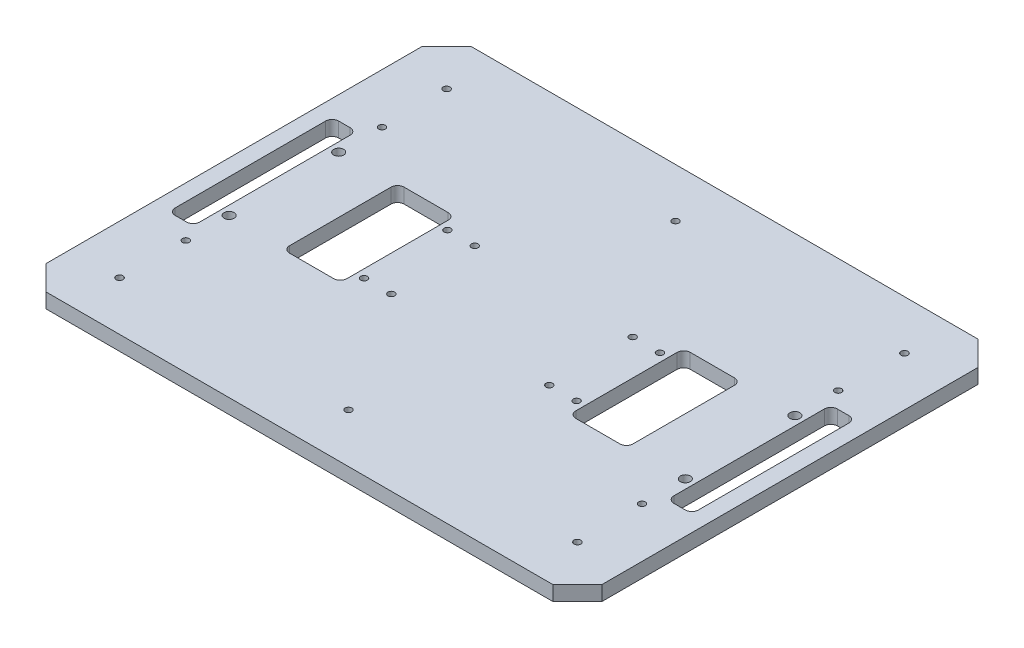
from build123d import *

# Parameters (mm, degrees)
ESQUISSE3_R                  = 2.1
BOSS_EXTRU_2_DEPTH           = 9
ESQUISSE4_R                  = 3.05
ENL_V_MAT_EXTRU_3_DEPTH      = 5
ESQUISSE5_R                  = 2.05
ENL_V_MAT_EXTRU_4_DEPTH      = 215.198506064
ENL_V_MAT_EXTRU_5_DEPTH      = 215.198506064
ENL_V_MAT_EXTRU_5_DEPTH_BACK = 215.198506064
ESQUISSE6_R                  = 2.05
ESQUISSE7_R                  = 2.05
ENL_V_MAT_EXTRU_6_DEPTH      = 215.198506064


with BuildPart() as part:
    # Esquisse3 → Boss.-Extru.2 (new body)
    with BuildSketch(Plane(origin=(0, 0, 0), x_dir=(1, 0, 0), z_dir=(0, 1, 0))):
        Polygon((155, 130), (-155, 130), (-170, 115), (-170, -115), (-155, -130), (155, -130), (170, -115), (170, 115), align=None)
        with Locations(Location((-140, 100, 0), (0, 0, 270))):
            Circle(ESQUISSE3_R, mode=Mode.SUBTRACT)
        with Locations(Location((-140, -100, 0), (0, 0, 90))):
            Circle(ESQUISSE3_R, mode=Mode.SUBTRACT)
        with Locations(Location((140, -100, 0), (0, 0, 270))):
            Circle(ESQUISSE3_R, mode=Mode.SUBTRACT)
        with Locations(Location((140, 100, 0), (0, 0, 90))):
            Circle(ESQUISSE3_R, mode=Mode.SUBTRACT)
        with BuildLine():
            Line((-160, -46), (-160, 46))
            ThreePointArc((-160, 46), (-158.828427125, 48.828427125), (-156, 50))
            Line((-156, 50), (-149, 50))
            ThreePointArc((-149, 50), (-146.171572875, 48.828427125), (-145, 46))
            Line((-145, 46), (-145, -46))
            ThreePointArc((-145, -46), (-146.171572875, -48.828427125), (-149, -50))
            Line((-149, -50), (-156, -50))
            ThreePointArc((-156, -50), (-158.828427125, -48.828427125), (-160, -46))
        make_face(mode=Mode.SUBTRACT)
        with BuildLine():
            Line((-105, 0), (-105, 31))
            ThreePointArc((-105, 31), (-103.828427125, 33.828427125), (-101, 35))
            Line((-101, 35), (-74, 35))
            ThreePointArc((-74, 35), (-71.171572875, 33.828427125), (-70, 31))
            Line((-70, 31), (-70, -31))
            ThreePointArc((-70, -31), (-71.171572875, -33.828427125), (-74, -35))
            Line((-74, -35), (-101, -35))
            ThreePointArc((-101, -35), (-103.828427125, -33.828427125), (-105, -31))
            Line((-105, -31), (-105, 0))
        make_face(mode=Mode.SUBTRACT)
        with BuildLine():
            Line((156, 50), (149, 50))
            ThreePointArc((149, 50), (146.171572875, 48.828427125), (145, 46))
            Line((145, 46), (145, -46))
            ThreePointArc((145, -46), (146.171572875, -48.828427125), (149, -50))
            Line((149, -50), (156, -50))
            ThreePointArc((156, -50), (158.828427125, -48.828427125), (160, -46))
            Line((160, -46), (160, 46))
            ThreePointArc((160, 46), (158.828427125, 48.828427125), (156, 50))
        make_face(mode=Mode.SUBTRACT)
        with BuildLine():
            Line((105, 0), (105, 31))
            ThreePointArc((105, 31), (103.828427125, 33.828427125), (101, 35))
            Line((101, 35), (74, 35))
            ThreePointArc((74, 35), (71.171572875, 33.828427125), (70, 31))
            Line((70, 31), (70, -31))
            ThreePointArc((70, -31), (71.171572875, -33.828427125), (74, -35))
            Line((74, -35), (101, -35))
            ThreePointArc((101, -35), (103.828427125, -33.828427125), (105, -31))
            Line((105, -31), (105, 0))
        make_face(mode=Mode.SUBTRACT)
    extrude(amount=-BOSS_EXTRU_2_DEPTH)

    # Esquisse4 → Enlèv. mat.-Extru.3 (cut)
    with BuildSketch(Plane(origin=(0, 0, 0), x_dir=(1, 0, 0), z_dir=(0, 1, 0))):
        with Locations(Location((-139.5, 33.5, 0), (0, 0, 270))):
            Circle(ESQUISSE4_R)
        with Locations(Location((-139.5, -33.5, 0), (0, 0, 90))):
            Circle(ESQUISSE4_R)
        with Locations(Location((139.5, -33.5, 0), (0, 0, 270))):
            Circle(ESQUISSE4_R)
        with Locations(Location((139.5, 33.5, 0), (0, 0, 90))):
            Circle(ESQUISSE4_R)
    extrude(amount=-ENL_V_MAT_EXTRU_3_DEPTH, mode=Mode.SUBTRACT)

    # Esquisse5 → Enlèv. mat.-Extru.4 (cut, through all)
    with BuildSketch(Plane(origin=(0, 0, 0), x_dir=(1, 0, 0), z_dir=(0, 1, 0))):
        with Locations(Location((-139.5, 60, 0), (0, 0, 270))):
            Circle(ESQUISSE5_R)
        with Locations(Location((-139.5, -60, 0), (0, 0, 90))):
            Circle(ESQUISSE5_R)
        with Locations(Location((139.5, -60, 0), (0, 0, 270))):
            Circle(ESQUISSE5_R)
        with Locations(Location((139.5, 60, 0), (0, 0, 90))):
            Circle(ESQUISSE5_R)
    extrude(amount=-ENL_V_MAT_EXTRU_4_DEPTH, mode=Mode.SUBTRACT)

    # Esquisse6 → Enlèv. mat.-Extru.5 (cut, two sides: drawn at the far end of the back side and taken through both)
    with BuildSketch(Plane(origin=(0, 0, 0), x_dir=(1, 0, 0), z_dir=(0, 1, 0)).offset(-ENL_V_MAT_EXTRU_5_DEPTH_BACK)):
        with Locations(Location((-65, 25.5, 0), (0, 0, 270))):
            Circle(ESQUISSE6_R)
        with Locations(Location((-48.3, 25.5, 0), (0, 0, 270))):
            Circle(ESQUISSE6_R)
        with Locations(Location((-48.3, -25.5, 0), (0, 0, 270))):
            Circle(ESQUISSE6_R)
        with Locations(Location((-65, -25.5, 0), (0, 0, 270))):
            Circle(ESQUISSE6_R)
        with Locations(Location((65, -25.5, 0), (0, 0, 270))):
            Circle(ESQUISSE6_R)
        with Locations(Location((48.3, -25.5, 0), (0, 0, 270))):
            Circle(ESQUISSE6_R)
        with Locations(Location((48.3, 25.5, 0), (0, 0, 270))):
            Circle(ESQUISSE6_R)
        with Locations(Location((65, 25.5, 0), (0, 0, 270))):
            Circle(ESQUISSE6_R)
    extrude(amount=ENL_V_MAT_EXTRU_5_DEPTH + ENL_V_MAT_EXTRU_5_DEPTH_BACK, mode=Mode.SUBTRACT)

    # Esquisse7 → Enlèv. mat.-Extru.6 (cut, through all)
    with BuildSketch(Plane(origin=(0, 0, 0), x_dir=(1, 0, 0), z_dir=(0, 1, 0))):
        with Locations(Location((0, 100, 0), (0, 0, 270))):
            Circle(ESQUISSE7_R)
        with Locations(Location((0, -100, 0), (0, 0, 90))):
            Circle(ESQUISSE7_R)
    extrude(amount=-ENL_V_MAT_EXTRU_6_DEPTH, mode=Mode.SUBTRACT)


solid = part.part
